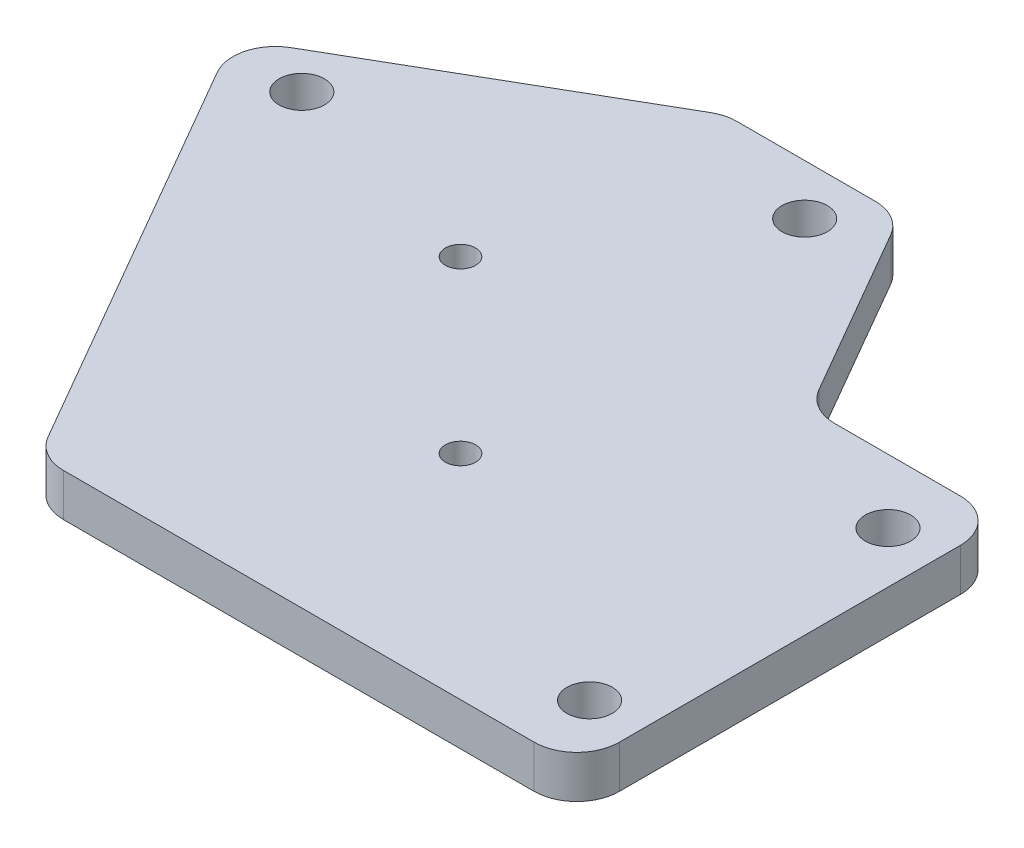
from build123d import *

# Parameters (mm, degrees)
BOSS_EXTRUDE1_DEPTH     = 6.35
FILLET1_R               = 6.35
F_1_4_CLEARANCE_HOLE2_D = 6.7564
F_8_CLEARANCE_HOLE1_D   = 4.4958


with BuildPart() as part:
    # Sketch1 → Boss-Extrude1 (new body)
    with BuildSketch(Plane(origin=(0, 0, 0), x_dir=(1, 0, 0), z_dir=(0, 1, 0))):
        Polygon((-26.866954165, 159.9), (-52.809618943, 159.9), (-99.343756128, 133.03350337), (-59.901828464, 64.718080709), (20.2, 64.718080709), (20.2, 128.218080709), (-8.575389533, 128.218080709), align=None)
    extrude(amount=-BOSS_EXTRUDE1_DEPTH)

    # Fillet1
    fillet1_edges = [part.edges().sort_by_distance(p)[0] for p in [
        (-52.809618943, -3.175, -159.9),
        (-26.866954165, -3.175, -159.9),
        (-8.575389533, -3.175, -128.218080709),
        (20.2, -3.175, -128.218080709),
        (20.2, -3.175, -64.718080709),
        (-59.901828464, -3.175, -64.718080709),
        (-99.343756128, -3.175, -133.03350337),
    ]]
    fillet(fillet1_edges, radius=FILLET1_R)

    # 1/4 Clearance Hole2 (through all)
    with Locations(Plane(origin=(0, -6.35, 0), x_dir=(-1, 0, 0), z_dir=(0, -1, 0))):
        with Locations((87.344864157, 131.300812842), (33.535349774, 152.4), (-12.58, 74.243080709), (-12.58, 118.693080709)):
            Hole(F_1_4_CLEARANCE_HOLE2_D / 2)

    # #8 Clearance Hole1 (through all)
    with Locations(Plane(origin=(0, 0, 0), x_dir=(1, 0, 0), z_dir=(0, 1, 0))):
        with Locations((-54.269039573, 121.866162864), (-28.872875262, 96.469998554)):
            Hole(F_8_CLEARANCE_HOLE1_D / 2)


solid = part.part
